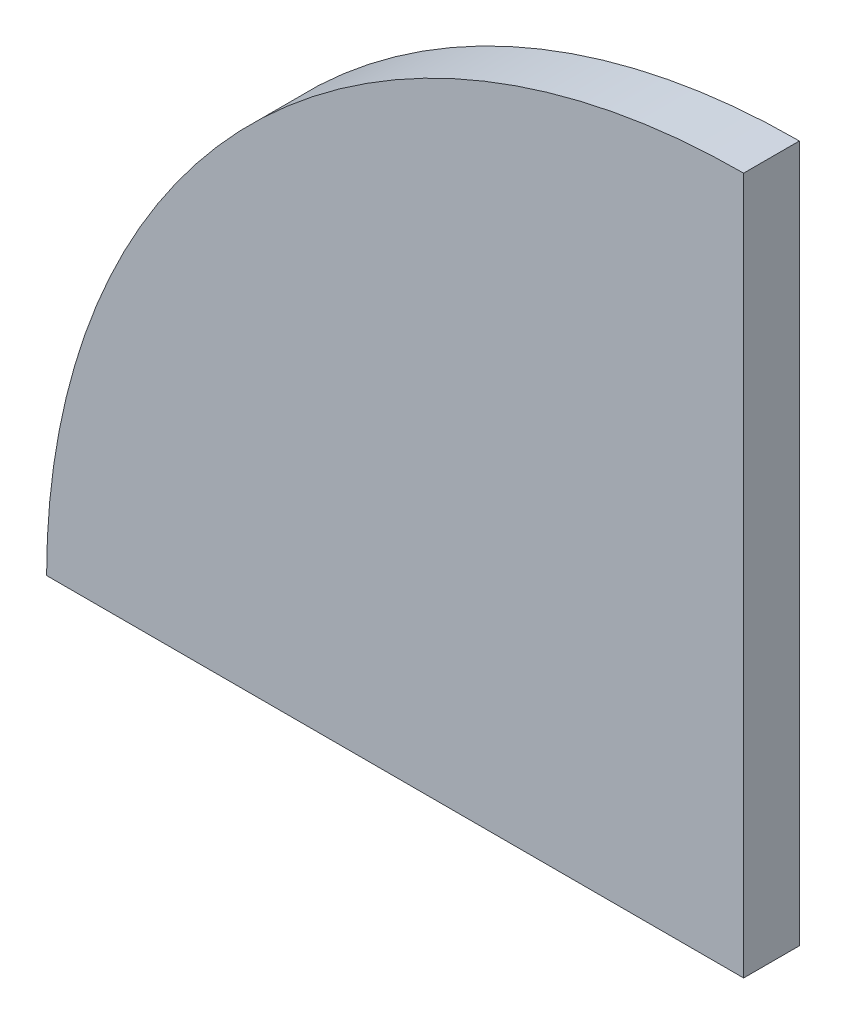
from build123d import *

# Parameters (mm, degrees)
EXTRUDE_1_DEPTH = 2


with BuildPart() as part:
    # 草图1 → 凸台-拉伸1 (new body)
    with BuildSketch(Plane.XY):
        with BuildLine():
            Line((0, 0), (0, 25))
            ThreePointArc((0, 25), (-17.67766953, 17.67766953), (-25, 0))
            Line((-25, 0), (0, 0))
        make_face()
    extrude(amount=EXTRUDE_1_DEPTH)


solid = part.part
